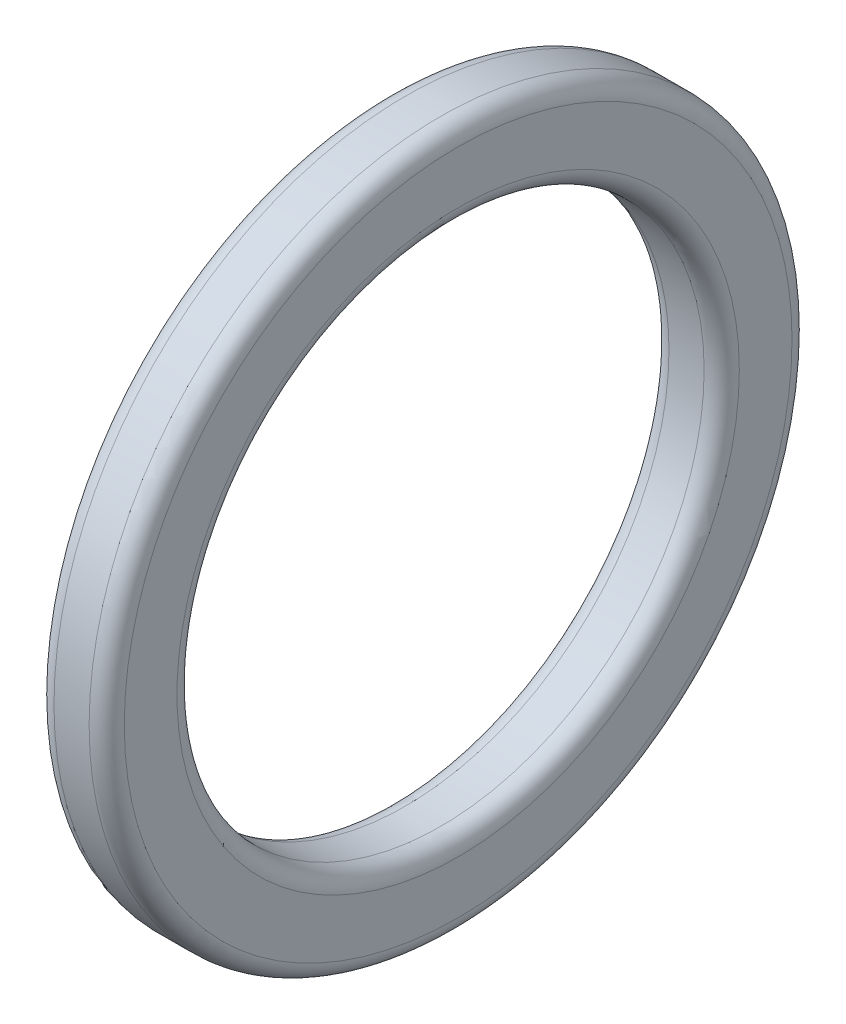
from build123d import *

# Parameters (mm, degrees)
ESQUISSE1_W = 4
ESQUISSE1_H = 5
CONG_1_R    = 1


with BuildPart() as part:
    # Esquisse1 → Base-Révolution (revolve)
    with BuildSketch(Plane.XY, mode=Mode.PRIVATE) as base_r_volution_sk:
        with Locations((2, 17.5)):
            Rectangle(ESQUISSE1_W, ESQUISSE1_H)
    revolve(base_r_volution_sk.sketch.rotate(Axis((0, 0, 0), (-1, 0, 0)), 90), axis=Axis((0, 0, 0), (-1, 0, 0)))

    # Congé1
    cong_1_edges = [part.edges().sort_by_distance(p)[0] for p in [
        (0, 0, 15),
        (4, 0, 15),
        (4, 0, 20),
        (0, 0, 20),
    ]]
    fillet(cong_1_edges, radius=CONG_1_R)


solid = part.part
